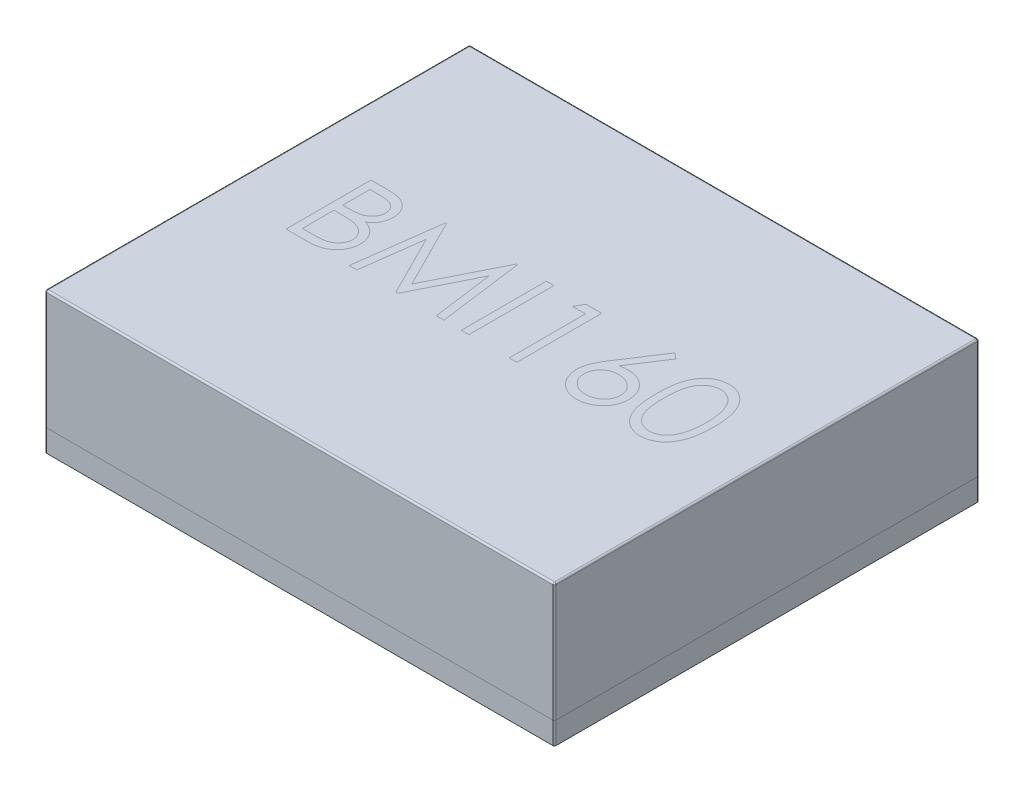
from build123d import *

# Parameters (mm, degrees)
IZIM1_W                       = 3
IZIM1_H                       = 2.5
Y_KSEKLIK_EKSTR_ZYON1_DEPTH   = 0.7
IZIM2_W                       = 3
IZIM2_H                       = 2.5
Y_KSEKLIK_EKSTR_ZYON2_DEPTH   = 0.13
RADYUS1_R                     = 0.01
RADYUS2_R                     = 0.01
IZIM3_W                       = 0.044871795
IZIM3_H                       = 0.5
KES_EKSTR_ZYON1_DEPTH         = 0.1
Y_KSEKLIK_EKSTR_ZYON3_DEPTH   = 0.1
Y_KSEKLIK_EKSTR_ZYON3_2_DEPTH = 0.1
IZIM3_2_W                     = 0.044871795
IZIM3_2_H                     = 0.5
Y_KSEKLIK_EKSTR_ZYON3_3_DEPTH = 0.1
Y_KSEKLIK_EKSTR_ZYON3_4_DEPTH = 0.1
Y_KSEKLIK_EKSTR_ZYON3_5_DEPTH = 0.1
Y_KSEKLIK_EKSTR_ZYON3_6_DEPTH = 0.1


with BuildPart() as part:
    # Çizim1 → Yükseklik-Ekstrüzyon1 (new body)
    with BuildSketch(Plane(origin=(0, 0, 0), x_dir=(1, 0, 0), z_dir=(0, 1, 0))):
        Rectangle(IZIM1_W, IZIM1_H)
    extrude(amount=Y_KSEKLIK_EKSTR_ZYON1_DEPTH)

    # Radyus1
    radyus1_edges = [part.edges().sort_by_distance(p)[0] for p in [
        (-1.5, 0.35, -1.25),
        (1.5, 0.35, -1.25),
        (-1.5, 0.35, 1.25),
        (1.5, 0.35, 1.25),
        (0, 0.7, -1.25),
        (-1.5, 0.7, 0),
        (1.5, 0.7, 0),
        (0, 0.7, 1.25),
    ]]
    fillet(radyus1_edges, radius=RADYUS1_R)

    # Çizim3 → Kes-Ekstrüzyon1 (cut)
    # profile 1 of 6: a face of its own
    with BuildSketch(Plane(origin=(0, 0.7, 0), x_dir=(1, 0, 0), z_dir=(0, 1, 0))):
        with BuildLine():
            Line((-1.099105135, 0.268739122), (-1.001549045, 0.268739122))
            add(Edge.make_bspline(
                [(-1.001549045, 0.268739122), (-0.996773548, 0.268714015), (-0.987517447, 0.268665351), (-0.974057526, 0.267910618), (-0.961450554, 0.266881522), (-0.949692872, 0.265248652), (-0.938789914, 0.263278398), (-0.928708823, 0.260892424), (-0.919481656, 0.258031479), (-0.908465551, 0.253482011), (-0.895905456, 0.246721558), (-0.882305686, 0.236731763), (-0.870676509, 0.22451284), (-0.860649892, 0.210729603), (-0.852678303, 0.19556735), (-0.846911261, 0.179387466), (-0.843260136, 0.162398646), (-0.842884645, 0.150735335), (-0.842694878, 0.144840885)],
                knots=[0, 0, 0, 0, 1.001505555, 1.941167018, 2.826882275, 3.653841531, 4.429895133, 5.150066043, 5.825578002, 6.45369114, 7.647487171, 8.808567382, 9.977351308, 11.170798116, 12.373658725, 13.556498008, 14.765093433, 16, 16, 16, 16], degree=3))
            add(Edge.make_bspline(
                [(-0.842694878, 0.144840885), (-0.842851052, 0.139319091), (-0.843157949, 0.128468246), (-0.846092629, 0.112597659), (-0.85068701, 0.097490342), (-0.857073475, 0.08320143), (-0.86537376, 0.070053771), (-0.875210662, 0.057941304), (-0.887078777, 0.047376868), (-0.895970668, 0.041470739), (-0.900487346, 0.038470693)],
                knots=[0, 0, 0, 0, 1.044552857, 2.05264487, 3.044412934, 4.028983338, 5.005914585, 5.980388656, 6.974128949, 8, 8, 8, 8], degree=3))
            add(Edge.make_bspline(
                [(-0.900487346, 0.038470693), (-0.894807285, 0.036289979), (-0.883939921, 0.032117732), (-0.868984777, 0.024741237), (-0.856099799, 0.016718079), (-0.845185921, 0.007956386), (-0.83585197, -0.00148773), (-0.82770155, -0.011752746), (-0.820747068, -0.022972569), (-0.814788079, -0.035030217), (-0.810138257, -0.047802569), (-0.806655985, -0.061169823), (-0.804660635, -0.075084045), (-0.804376686, -0.084553385), (-0.80423334, -0.089333794)],
                knots=[0, 0, 0, 0, 1.27268992, 2.434971085, 3.483601985, 4.442670788, 5.356604649, 6.2567628, 7.179492994, 8.113709626, 9.066344395, 10.018646069, 10.999752585, 12, 12, 12, 12], degree=3))
            add(Edge.make_bspline(
                [(-0.80423334, -0.089333794), (-0.804372889, -0.094214776), (-0.804647457, -0.103818245), (-0.806673167, -0.117926121), (-0.81010304, -0.131408256), (-0.814827489, -0.144351854), (-0.820993534, -0.156731873), (-0.828497529, -0.168562339), (-0.837444895, -0.179724386), (-0.847453876, -0.190342047), (-0.85877704, -0.199888874), (-0.870993576, -0.208391117), (-0.884257336, -0.215383412), (-0.898350478, -0.221257129), (-0.913431095, -0.225743872), (-0.929431467, -0.228882811), (-0.946337796, -0.230997816), (-0.957939189, -0.231171703), (-0.963888789, -0.231260878)],
                knots=[0, 0, 0, 0, 0.978564426, 1.925352924, 2.850884081, 3.763762016, 4.682927383, 5.618979971, 6.567305752, 7.547517671, 8.540179244, 9.531824382, 10.526200242, 11.540722885, 12.589160233, 13.674978461, 14.80764778, 16, 16, 16, 16], degree=3))
            Line((-0.963888789, -0.231260878), (-1.099105135, -0.231260878))
            Line((-1.099105135, -0.231260878), (-1.099105135, 0.268739122))
        make_face()
        with BuildLine():
            Line((-1.05423334, 0.217457071), (-1.05423334, 0.057200661))
            Line((-1.05423334, 0.057200661), (-1.024085103, 0.057200661))
            add(Edge.make_bspline(
                [(-1.024085103, 0.057200661), (-1.019678132, 0.057257792), (-1.011162966, 0.057368183), (-0.998831553, 0.0576844), (-0.987385121, 0.058569834), (-0.976843431, 0.059455015), (-0.967223082, 0.060894241), (-0.958545387, 0.062607402), (-0.950674159, 0.064419245), (-0.941597081, 0.067500601), (-0.931300946, 0.072054554), (-0.920324788, 0.07912196), (-0.910648435, 0.087539724), (-0.902477408, 0.097252719), (-0.895790056, 0.107947888), (-0.891145239, 0.119454585), (-0.887995627, 0.131486033), (-0.887711123, 0.139745783), (-0.887566673, 0.143939443)],
                knots=[0, 0, 0, 0, 1.156816544, 2.235205308, 3.236616184, 4.169592532, 5.011045266, 5.787822928, 6.49130361, 7.128639758, 8.301311294, 9.436451833, 10.541879658, 11.654887649, 12.756523258, 13.837046038, 14.901820046, 16, 16, 16, 16], degree=3))
            add(Edge.make_bspline(
                [(-0.887566673, 0.143939443), (-0.887641842, 0.146714553), (-0.887789293, 0.152158235), (-0.888996908, 0.160093857), (-0.891049419, 0.16755725), (-0.893685746, 0.174650694), (-0.897369845, 0.181152387), (-0.901707482, 0.187287129), (-0.906948295, 0.192846003), (-0.912913625, 0.198041646), (-0.919772, 0.202648007), (-0.927519328, 0.206682402), (-0.936260424, 0.209931084), (-0.945847975, 0.212776249), (-0.956429559, 0.214774577), (-0.967883067, 0.216439346), (-0.980302312, 0.217286881), (-0.98889447, 0.217399076), (-0.993335904, 0.217457071)],
                knots=[0, 0, 0, 0, 0.91205012, 1.789085906, 2.630437955, 3.453916878, 4.269457761, 5.079663411, 5.91843418, 6.774407191, 7.675494373, 8.627863946, 9.638891023, 10.736472738, 11.911756761, 13.175263542, 14.539845004, 16, 16, 16, 16], degree=3))
            Line((-0.993335904, 0.217457071), (-1.05423334, 0.217457071))
        make_face(mode=Mode.SUBTRACT)
        with BuildLine():
            Line((-1.05423334, 0.005918609), (-1.05423334, -0.179978827))
            Line((-1.05423334, -0.179978827), (-0.990331096, -0.179978827))
            add(Edge.make_bspline(
                [(-0.990331096, -0.179978827), (-0.985756964, -0.179924005), (-0.976940927, -0.179818345), (-0.96421218, -0.179473409), (-0.952414594, -0.178688798), (-0.941602003, -0.177453677), (-0.931657653, -0.176113898), (-0.922700838, -0.174312287), (-0.914658953, -0.172248149), (-0.905334052, -0.169057553), (-0.894833551, -0.164100915), (-0.883517714, -0.156627454), (-0.873456826, -0.147724124), (-0.864913217, -0.137419708), (-0.857911362, -0.126215232), (-0.852817725, -0.114337325), (-0.849676174, -0.10198225), (-0.849295865, -0.093558434), (-0.849105135, -0.089333794)],
                knots=[0, 0, 0, 0, 1.160039823, 2.235823828, 3.228722157, 4.157150951, 4.99529583, 5.772374946, 6.472645482, 7.099169577, 8.269452708, 9.405989375, 10.527446681, 11.663510218, 12.788923519, 13.866172445, 14.929861265, 16, 16, 16, 16], degree=3))
            add(Edge.make_bspline(
                [(-0.849105135, -0.089333794), (-0.849144578, -0.086691889), (-0.849222829, -0.081450691), (-0.850402917, -0.073748431), (-0.852119184, -0.066287592), (-0.85433796, -0.059047915), (-0.857569313, -0.05216029), (-0.861341676, -0.045488496), (-0.865764734, -0.039023713), (-0.872656757, -0.030850534), (-0.882681327, -0.021433818), (-0.896925152, -0.012214175), (-0.913121194, -0.004778774), (-0.924867979, -0.001621706), (-0.930936064, 9.154e-06)],
                knots=[0, 0, 0, 0, 0.723448775, 1.435228256, 2.130040452, 2.821711965, 3.505591119, 4.210454504, 4.921174351, 5.648778258, 7.137944449, 8.670945889, 10.280296675, 12, 12, 12, 12], degree=3))
            add(Edge.make_bspline(
                [(-0.930936064, 9.154e-06), (-0.933368792, 0.000502738), (-0.938643448, 0.001572928), (-0.947244531, 0.0027026), (-0.957063941, 0.003709037), (-0.968124352, 0.004453488), (-0.980439758, 0.005222995), (-0.994036461, 0.005522255), (-1.008858934, 0.005879292), (-1.019143559, 0.005905168), (-1.024485744, 0.005918609)],
                knots=[0, 0, 0, 0, 0.634451884, 1.375622551, 2.216452059, 3.157844607, 4.20941857, 5.370758133, 6.634282058, 8, 8, 8, 8], degree=3))
            Line((-1.024485744, 0.005918609), (-1.05423334, 0.005918609))
        make_face(mode=Mode.SUBTRACT)
    # profile 2 of 6: a face of its own
    with BuildSketch(Plane(origin=(0, 0.7, 0), x_dir=(1, 0, 0), z_dir=(0, 1, 0))):
        Polygon((-0.727310263, -0.231260878), (-0.661304654, 0.268739122), (-0.654894398, 0.268739122), (-0.448464109, -0.141517288), (-0.242534622, 0.268739122), (-0.236024205, 0.268739122), (-0.169617955, -0.231260878), (-0.214690071, -0.231260878), (-0.262566673, 0.128514763), (-0.443055455, -0.231260878), (-0.453171641, -0.231260878), (-0.634361545, 0.129316045), (-0.682137987, -0.231260878), align=None)
    # profile 3 of 6: a face of its own
    with BuildSketch(Plane(origin=(0, 0.7, 0), x_dir=(1, 0, 0), z_dir=(0, 1, 0))):
        with Locations((-0.044617956, 0.018739122)):
            Rectangle(IZIM3_W, IZIM3_H)
    # profile 4 of 6: a face of its own
    with BuildSketch(Plane(origin=(0, 0.7, 0), x_dir=(1, 0, 0), z_dir=(0, 1, 0))):
        Polygon((0.167421307, 0.268739122), (0.259869224, 0.268739122), (0.259869224, -0.231260878), (0.214997429, -0.231260878), (0.214997429, 0.217457071), (0.138074352, 0.217457071), align=None)
    # profile 5 of 6: a face of its own
    with BuildSketch(Plane(origin=(0, 0.7, 0), x_dir=(1, 0, 0), z_dir=(0, 1, 0))):
        with BuildLine():
            Line((0.676535891, 0.281559635), (0.711091179, 0.254416206))
            Line((0.711091179, 0.254416206), (0.578979801, 0.052392968))
            add(Edge.make_bspline(
                [(0.578979801, 0.052392968), (0.587775555, 0.053794948), (0.604932667, 0.056529669), (0.622299224, 0.056980804), (0.630762654, 0.057200661)],
                knots=[0, 0, 0, 0, 1.025318673, 2, 2, 2, 2], degree=3))
            add(Edge.make_bspline(
                [(0.630762654, 0.057200661), (0.635844439, 0.057064073), (0.645847782, 0.056795205), (0.660534468, 0.054726084), (0.674647173, 0.051465353), (0.688127403, 0.046712174), (0.701023543, 0.040640409), (0.7134096, 0.033363427), (0.725052744, 0.024505473), (0.736102913, 0.014610479), (0.746135355, 0.00365091), (0.755017649, -0.007977852), (0.762478619, -0.020263692), (0.768532037, -0.033200387), (0.773232734, -0.046767996), (0.77665954, -0.060949159), (0.778685196, -0.075753655), (0.778960266, -0.085821965), (0.779099993, -0.090936359)],
                knots=[0, 0, 0, 0, 1.04369286, 2.054478336, 3.041073146, 4.015093852, 4.984733326, 5.965804835, 6.960378782, 7.985147595, 9.009457201, 10.008161701, 10.986880575, 11.956520048, 12.937015923, 13.931873656, 14.949455224, 16, 16, 16, 16], degree=3))
            add(Edge.make_bspline(
                [(0.779099993, -0.090936359), (0.778896693, -0.097933459), (0.778496645, -0.111702097), (0.774510388, -0.131755912), (0.768316153, -0.150860557), (0.759462221, -0.16871101), (0.748464738, -0.185282806), (0.735053653, -0.199966444), (0.719704583, -0.213062164), (0.702349326, -0.224013109), (0.68367176, -0.232956402), (0.664050046, -0.239380008), (0.643674739, -0.24333479), (0.62984551, -0.24383059), (0.622849993, -0.244081391)],
                knots=[0, 0, 0, 0, 1.031375318, 2.029502543, 3.004789286, 3.987476834, 4.960371455, 5.9300674, 6.912260825, 7.929083631, 8.949397511, 9.960523116, 10.96833055, 12, 12, 12, 12], degree=3))
            add(Edge.make_bspline(
                [(0.622849993, -0.244081391), (0.616121893, -0.243863076), (0.602794705, -0.243430632), (0.58319002, -0.239578355), (0.564352446, -0.233334483), (0.546413963, -0.224732443), (0.529796733, -0.213867031), (0.514930213, -0.200786706), (0.501888531, -0.185771068), (0.491035014, -0.168822447), (0.482426624, -0.150609596), (0.47597092, -0.131618573), (0.472200028, -0.111918576), (0.471673091, -0.098564127), (0.471407686, -0.091837801)],
                knots=[0, 0, 0, 0, 1.012016664, 2.004627821, 2.994792927, 3.992885782, 4.990978636, 5.973936114, 6.964471063, 7.975201453, 8.993600317, 9.990122807, 10.98767138, 12, 12, 12, 12], degree=3))
            add(Edge.make_bspline(
                [(0.471407686, -0.091837801), (0.471576464, -0.086688575), (0.471921076, -0.076174839), (0.474327274, -0.060251406), (0.478193674, -0.043958394), (0.482523709, -0.030136367), (0.487098796, -0.018813292), (0.490906302, -0.009684222), (0.495645444, -0.000289783), (0.500698784, 0.009692165), (0.506521194, 0.02000437), (0.512852001, 0.030819179), (0.519866237, 0.041964598), (0.524783403, 0.049528054), (0.527297109, 0.053394571)],
                knots=[0, 0, 0, 0, 1.173818275, 2.396712641, 3.66331629, 4.989737886, 5.693666774, 6.447286557, 7.243889047, 8.091586357, 8.998013824, 9.943181721, 10.948533338, 12, 12, 12, 12], degree=3))
            Line((0.527297109, 0.053394571), (0.676535891, 0.281559635))
        make_face()
        with BuildLine():
            add(Edge.make_bspline(
                [(0.62134759, 0.005918609), (0.617538697, 0.00580746), (0.610098825, 0.005590354), (0.59918348, 0.004329603), (0.588853015, 0.001955451), (0.578970568, -0.00106831), (0.569720896, -0.00522589), (0.561036776, -0.010276147), (0.552884625, -0.01622203), (0.545349832, -0.022979303), (0.538518452, -0.030377593), (0.532635433, -0.038301811), (0.527560805, -0.046560983), (0.52343483, -0.055224117), (0.520221962, -0.064287903), (0.517897927, -0.073710653), (0.516604534, -0.083555554), (0.516389358, -0.090231626), (0.516279481, -0.093640686)],
                knots=[0, 0, 0, 0, 1.129588631, 2.206414736, 3.251139165, 4.268635594, 5.265702196, 6.250456724, 7.242448911, 8.251968645, 9.246821453, 10.222880186, 11.173611482, 12.116736599, 13.062300278, 14.020270554, 14.989073742, 16, 16, 16, 16], degree=3))
            add(Edge.make_bspline(
                [(0.516279481, -0.093640686), (0.516368961, -0.097019254), (0.516544418, -0.103644124), (0.518137607, -0.113406864), (0.52057119, -0.122801851), (0.524191246, -0.131780651), (0.528509373, -0.140480125), (0.534210134, -0.148585166), (0.540526818, -0.156588033), (0.54807738, -0.163873957), (0.556180717, -0.170653475), (0.564838032, -0.176579225), (0.573860883, -0.181648679), (0.583371086, -0.185621693), (0.593233713, -0.188882305), (0.603530935, -0.191176802), (0.614269914, -0.19247402), (0.621544477, -0.192689476), (0.62525384, -0.192799339)],
                knots=[0, 0, 0, 0, 0.989467248, 1.94019797, 2.891935182, 3.827694429, 4.772920941, 5.730924762, 6.725747692, 7.756678648, 8.79901574, 9.819492441, 10.826891316, 11.826466727, 12.835195252, 13.867842842, 14.912794438, 16, 16, 16, 16], degree=3))
            add(Edge.make_bspline(
                [(0.62525384, -0.192799339), (0.628963196, -0.192689468), (0.636237747, -0.192473995), (0.646976813, -0.191176899), (0.657273716, -0.188881949), (0.667137502, -0.185622982), (0.676643421, -0.181643895), (0.685658381, -0.176610764), (0.694233823, -0.170617033), (0.70234248, -0.163885543), (0.709861614, -0.156546564), (0.716329797, -0.148656604), (0.721855973, -0.140414619), (0.726346571, -0.13181492), (0.729926756, -0.122796422), (0.73237268, -0.113408318), (0.733962578, -0.103643743), (0.734138488, -0.097019125), (0.734228198, -0.093640686)],
                knots=[0, 0, 0, 0, 1.087397944, 2.132534446, 3.165364764, 4.174271784, 5.174024072, 6.181601208, 7.194203697, 8.236725232, 9.267838612, 10.269026844, 11.221737037, 12.171628256, 13.107553087, 14.05945871, 15.010357665, 16, 16, 16, 16], degree=3))
            add(Edge.make_bspline(
                [(0.734228198, -0.093640686), (0.734149585, -0.090227178), (0.733995293, -0.083527574), (0.732250157, -0.073715057), (0.729829818, -0.064240027), (0.7261751, -0.055162035), (0.721427022, -0.046516902), (0.715643678, -0.038260959), (0.708953311, -0.030330909), (0.701225091, -0.022964794), (0.6928122, -0.016229497), (0.683867117, -0.010283846), (0.674508835, -0.005265992), (0.664746843, -0.001079264), (0.654469288, 0.00194209), (0.643842097, 0.004321125), (0.632729348, 0.005587127), (0.625189832, 0.005806708), (0.62134759, 0.005918609)],
                knots=[0, 0, 0, 0, 0.978206639, 1.919901502, 2.851605144, 3.780102724, 4.718870031, 5.675451981, 6.667674623, 7.690630536, 8.733308323, 9.756129687, 10.767539656, 11.776269907, 12.797430371, 13.836405707, 14.897401972, 16, 16, 16, 16], degree=3))
        make_face(mode=Mode.SUBTRACT)
    # profile 6 of 6: a face of its own
    with BuildSketch(Plane(origin=(0, 0.7, 0), x_dir=(1, 0, 0), z_dir=(0, 1, 0))):
        with BuildLine():
            add(Edge.make_bspline(
                [(0.830382045, 0.018538802), (0.830428904, 0.026552714), (0.83051993, 0.042119855), (0.831532562, 0.064803375), (0.833214753, 0.086083416), (0.835520092, 0.105960997), (0.838325518, 0.124441249), (0.842070588, 0.141474786), (0.846329559, 0.157140444), (0.851265623, 0.171489308), (0.856835307, 0.184714694), (0.862897345, 0.197061152), (0.869692315, 0.208509999), (0.876831874, 0.219243969), (0.884605027, 0.229087354), (0.892790569, 0.238179163), (0.90170798, 0.24630927), (0.911054124, 0.253715885), (0.920913619, 0.260208667), (0.931005428, 0.265927629), (0.941399015, 0.270813325), (0.952122755, 0.274654815), (0.963080263, 0.277827794), (0.974309844, 0.279997643), (0.985830039, 0.281362916), (0.993605958, 0.28149344), (0.997549513, 0.281559635)],
                knots=[0, 0, 0, 0, 1.646270934, 3.197905019, 4.663502075, 6.030701355, 7.308322542, 8.50163776, 9.611534131, 10.641858119, 11.616356847, 12.558055219, 13.465016945, 14.349605745, 15.204443733, 16.039544428, 16.859896111, 17.680448484, 18.487036065, 19.28249412, 20.06191084, 20.843045899, 21.620316918, 22.403196591, 23.190181807, 24, 24, 24, 24], degree=3))
            add(Edge.make_bspline(
                [(0.997549513, 0.281559635), (1.00152601, 0.281489947), (1.009434011, 0.28135136), (1.021125493, 0.280019368), (1.032546876, 0.277809208), (1.043649467, 0.27467764), (1.054524465, 0.270792543), (1.065086809, 0.265922955), (1.075402107, 0.260254545), (1.085306433, 0.253593991), (1.094908521, 0.246167952), (1.103972516, 0.237773285), (1.112499243, 0.228494754), (1.120595715, 0.21843163), (1.128032229, 0.207390904), (1.135114148, 0.195564602), (1.14145301, 0.182745908), (1.147557964, 0.169148698), (1.152827533, 0.154396747), (1.157579854, 0.138573209), (1.161419706, 0.121491183), (1.164618174, 0.10324029), (1.167096016, 0.083753507), (1.168900679, 0.063072605), (1.169853977, 0.041183978), (1.170033506, 0.026218571), (1.170125634, 0.018538802)],
                knots=[0, 0, 0, 0, 0.810914788, 1.612654377, 2.396697861, 3.181598691, 3.963628158, 4.749916497, 5.551656086, 6.361998678, 7.18212741, 8.025565596, 8.878627764, 9.750805457, 10.657531673, 11.591944965, 12.560506719, 13.57287815, 14.630710178, 15.753379473, 16.941251878, 18.199788006, 19.531962791, 20.947069417, 22.433333509, 24, 24, 24, 24], degree=3))
            add(Edge.make_bspline(
                [(1.170125634, 0.018538802), (1.170032551, 0.010892529), (1.169851181, -0.004005921), (1.168911366, -0.025796061), (1.167060133, -0.04636721), (1.164744421, -0.065768704), (1.16153714, -0.083919793), (1.157593545, -0.100883285), (1.153214927, -0.116732438), (1.147809957, -0.131337411), (1.141894141, -0.144901943), (1.135457684, -0.157568679), (1.128561995, -0.169449578), (1.121049317, -0.180449542), (1.113041687, -0.190646493), (1.104367717, -0.199860439), (1.095271919, -0.208313392), (1.085641574, -0.215835053), (1.075582781, -0.222418596), (1.065302913, -0.228306289), (1.054619572, -0.233053817), (1.043774865, -0.237130252), (1.03261367, -0.240244602), (1.021149899, -0.24239801), (1.009441866, -0.243908274), (1.001527356, -0.244023485), (0.997549513, -0.244081391)],
                knots=[0, 0, 0, 0, 1.561518951, 3.042555995, 4.452378317, 5.7783523, 7.031515105, 8.214008947, 9.334062868, 10.386615937, 11.391082383, 12.354592575, 13.286541444, 14.194233754, 15.072674879, 15.931287219, 16.775624067, 17.606195743, 18.42308326, 19.229000347, 20.022332153, 20.807536673, 21.593273796, 22.3848459, 23.188221202, 24, 24, 24, 24], degree=3))
            add(Edge.make_bspline(
                [(0.997549513, -0.244081391), (0.993606068, -0.244014768), (0.985830364, -0.243883402), (0.974308589, -0.242524298), (0.963125383, -0.240339226), (0.952225561, -0.237279711), (0.941553202, -0.233534735), (0.931253732, -0.228655637), (0.921212634, -0.223036484), (0.911456698, -0.216637138), (0.902169246, -0.209305469), (0.893298017, -0.201196285), (0.885065871, -0.192107226), (0.877403858, -0.182181809), (0.870121845, -0.171511346), (0.863423363, -0.159950149), (0.857227527, -0.147544062), (0.851564171, -0.134212932), (0.846542933, -0.119762228), (0.842107547, -0.104026631), (0.838605524, -0.086867255), (0.835607959, -0.068421917), (0.83319019, -0.048611355), (0.831539572, -0.027424815), (0.830519384, -0.0048755), (0.83042866, 0.010591611), (0.830382045, 0.018538802)],
                knots=[0, 0, 0, 0, 0.810891512, 1.598919785, 2.382837074, 3.152667961, 3.926044502, 4.706494248, 5.493654104, 6.291793342, 7.103789334, 7.925228297, 8.761435821, 9.622817696, 10.50288917, 11.416980706, 12.369136599, 13.353924996, 14.394355917, 15.514179734, 16.714354668, 17.994756427, 19.357759367, 20.818452758, 22.365282078, 24, 24, 24, 24], degree=3))
        make_face()
        with BuildLine():
            add(Edge.make_bspline(
                [(0.87525384, 0.018739122), (0.875270903, 0.012060737), (0.875304021, -0.000900698), (0.876169193, -0.01973545), (0.877347797, -0.03730264), (0.878867982, -0.053624574), (0.881125546, -0.068646004), (0.883655088, -0.082470244), (0.886733386, -0.095024135), (0.890375532, -0.106393823), (0.894523974, -0.116772261), (0.899053383, -0.126429577), (0.903919201, -0.135479854), (0.909364794, -0.143841798), (0.915295517, -0.151542679), (0.921577411, -0.158718798), (0.928444923, -0.165118366), (0.937945458, -0.172793631), (0.950487811, -0.180724936), (0.966290733, -0.18763152), (0.982529083, -0.191971871), (0.993550691, -0.192523836), (0.999051916, -0.192799339)],
                knots=[0, 0, 0, 0, 1.459021318, 2.831673884, 4.118529203, 5.306027144, 6.411944654, 7.436330062, 8.375795394, 9.233974572, 10.042671642, 10.816086306, 11.563610507, 12.285937304, 12.993564865, 13.685989202, 14.367179055, 15.041617293, 16.353048772, 17.594441528, 18.799311195, 20, 20, 20, 20], degree=3))
            add(Edge.make_bspline(
                [(0.999051916, -0.192799339), (1.004588727, -0.192571085), (1.015650916, -0.192115047), (1.031812886, -0.187715228), (1.047502925, -0.181076722), (1.059798916, -0.173227079), (1.069153566, -0.165751603), (1.075855993, -0.159378082), (1.082007714, -0.152241529), (1.087842296, -0.14454163), (1.093193593, -0.136131275), (1.098059755, -0.127050907), (1.102500233, -0.11727531), (1.105030097, -0.110451062), (1.106323551, -0.106962)],
                knots=[0, 0, 0, 0, 1.353760809, 2.704726607, 4.075137775, 5.516104923, 6.260822281, 7.007110065, 7.778089737, 8.566572457, 9.372053459, 10.217411131, 11.088608312, 12, 12, 12, 12], degree=3))
            add(Edge.make_bspline(
                [(1.106323551, -0.106962), (1.107830946, -0.102500608), (1.110891606, -0.093442071), (1.114836145, -0.07939012), (1.11794263, -0.064646868), (1.120737397, -0.049300423), (1.122644976, -0.033237609), (1.124180378, -0.016508125), (1.125084762, 0.000900641), (1.125196869, 0.012728497), (1.12525384, 0.018739122)],
                knots=[0, 0, 0, 0, 0.884706709, 1.796334032, 2.740027952, 3.714592787, 4.726048262, 5.777819803, 6.87074269, 8, 8, 8, 8], degree=3))
            add(Edge.make_bspline(
                [(1.12525384, 0.018739122), (1.125175241, 0.024748775), (1.125021486, 0.036504942), (1.124433773, 0.053721825), (1.12291612, 0.070074362), (1.121230531, 0.085633001), (1.118745214, 0.100311616), (1.116065527, 0.114233088), (1.112465354, 0.127224948), (1.108619672, 0.139490603), (1.104218187, 0.150890697), (1.099373082, 0.16147838), (1.094198545, 0.17130477), (1.088578225, 0.180342904), (1.082578842, 0.188633267), (1.076042049, 0.196009638), (1.069227138, 0.202700633), (1.059681826, 0.210338143), (1.047185499, 0.218125528), (1.031636121, 0.225292065), (1.0154546, 0.229407536), (1.004515535, 0.229987777), (0.999051916, 0.230277584)],
                knots=[0, 0, 0, 0, 1.31362396, 2.569729283, 3.763502607, 4.902122613, 5.988968491, 7.01645872, 7.998833611, 8.933434873, 9.825090667, 10.667526885, 11.477055099, 12.250526234, 12.991942729, 13.710640831, 14.402115721, 15.076753259, 16.378508321, 17.609869233, 18.806226677, 20, 20, 20, 20], degree=3))
            add(Edge.make_bspline(
                [(0.999051916, 0.230277584), (0.993521832, 0.229987377), (0.982451588, 0.229406435), (0.96610188, 0.225307399), (0.95042983, 0.218162689), (0.937966548, 0.21031235), (0.928414579, 0.202835449), (0.921688479, 0.19635167), (0.915381883, 0.189259348), (0.909572212, 0.181487645), (0.904130886, 0.17313545), (0.899133598, 0.164137055), (0.894631123, 0.15444686), (0.890476189, 0.144073084), (0.886822933, 0.132704377), (0.88380951, 0.12016595), (0.881025645, 0.10638568), (0.879054893, 0.091282893), (0.877302928, 0.074956871), (0.876177021, 0.057345825), (0.875301127, 0.038479485), (0.875269918, 0.025451034), (0.87525384, 0.018739122)],
                knots=[0, 0, 0, 0, 1.207732386, 2.417664972, 3.655092373, 4.956220595, 5.625982001, 6.301752483, 6.994047911, 7.697131622, 8.419323945, 9.170223765, 9.943494443, 10.752040957, 11.610060368, 12.549350801, 13.567764191, 14.679664412, 15.874934091, 17.154273443, 18.533957287, 20, 20, 20, 20], degree=3))
        make_face(mode=Mode.SUBTRACT)
    extrude(amount=-KES_EKSTR_ZYON1_DEPTH, mode=Mode.SUBTRACT)


with BuildPart() as body_2:
    # Çizim2 → Yükseklik-Ekstrüzyon2 (new body)
    with BuildSketch(Plane.XZ):
        Rectangle(IZIM2_W, IZIM2_H)
    extrude(amount=Y_KSEKLIK_EKSTR_ZYON2_DEPTH)

    # Radyus2
    radyus2_edges = [body_2.edges().sort_by_distance(p)[0] for p in [
        (1.5, -0.065, 1.25),
        (-1.5, -0.065, 1.25),
        (1.5, -0.065, -1.25),
        (-1.5, -0.065, -1.25),
    ]]
    fillet(radyus2_edges, radius=RADYUS2_R)


with BuildPart() as body_3:
    # Çizim3<2> → Yükseklik-Ekstrüzyon3 (new body)
    with BuildSketch(Plane(origin=(0, 0.7, 0), x_dir=(1, 0, 0), z_dir=(0, 1, 0))):
        with BuildLine():
            Line((-1.099105135, 0.268739122), (-1.001549045, 0.268739122))
            add(Edge.make_bspline(
                [(-1.001549045, 0.268739122), (-0.996773548, 0.268714015), (-0.987517447, 0.268665351), (-0.974057526, 0.267910618), (-0.961450554, 0.266881522), (-0.949692872, 0.265248652), (-0.938789914, 0.263278398), (-0.928708823, 0.260892424), (-0.919481656, 0.258031479), (-0.908465551, 0.253482011), (-0.895905456, 0.246721558), (-0.882305686, 0.236731763), (-0.870676509, 0.22451284), (-0.860649892, 0.210729603), (-0.852678303, 0.19556735), (-0.846911261, 0.179387466), (-0.843260136, 0.162398646), (-0.842884645, 0.150735335), (-0.842694878, 0.144840885)],
                knots=[0, 0, 0, 0, 1.001505555, 1.941167018, 2.826882275, 3.653841531, 4.429895133, 5.150066043, 5.825578002, 6.45369114, 7.647487171, 8.808567382, 9.977351308, 11.170798116, 12.373658725, 13.556498008, 14.765093433, 16, 16, 16, 16], degree=3))
            add(Edge.make_bspline(
                [(-0.842694878, 0.144840885), (-0.842851052, 0.139319091), (-0.843157949, 0.128468246), (-0.846092629, 0.112597659), (-0.85068701, 0.097490342), (-0.857073475, 0.08320143), (-0.86537376, 0.070053771), (-0.875210662, 0.057941304), (-0.887078777, 0.047376868), (-0.895970668, 0.041470739), (-0.900487346, 0.038470693)],
                knots=[0, 0, 0, 0, 1.044552857, 2.05264487, 3.044412934, 4.028983338, 5.005914585, 5.980388656, 6.974128949, 8, 8, 8, 8], degree=3))
            add(Edge.make_bspline(
                [(-0.900487346, 0.038470693), (-0.894807285, 0.036289979), (-0.883939921, 0.032117732), (-0.868984777, 0.024741237), (-0.856099799, 0.016718079), (-0.845185921, 0.007956386), (-0.83585197, -0.00148773), (-0.82770155, -0.011752746), (-0.820747068, -0.022972569), (-0.814788079, -0.035030217), (-0.810138257, -0.047802569), (-0.806655985, -0.061169823), (-0.804660635, -0.075084045), (-0.804376686, -0.084553385), (-0.80423334, -0.089333794)],
                knots=[0, 0, 0, 0, 1.27268992, 2.434971085, 3.483601985, 4.442670788, 5.356604649, 6.2567628, 7.179492994, 8.113709626, 9.066344395, 10.018646069, 10.999752585, 12, 12, 12, 12], degree=3))
            add(Edge.make_bspline(
                [(-0.80423334, -0.089333794), (-0.804372889, -0.094214776), (-0.804647457, -0.103818245), (-0.806673167, -0.117926121), (-0.81010304, -0.131408256), (-0.814827489, -0.144351854), (-0.820993534, -0.156731873), (-0.828497529, -0.168562339), (-0.837444895, -0.179724386), (-0.847453876, -0.190342047), (-0.85877704, -0.199888874), (-0.870993576, -0.208391117), (-0.884257336, -0.215383412), (-0.898350478, -0.221257129), (-0.913431095, -0.225743872), (-0.929431467, -0.228882811), (-0.946337796, -0.230997816), (-0.957939189, -0.231171703), (-0.963888789, -0.231260878)],
                knots=[0, 0, 0, 0, 0.978564426, 1.925352924, 2.850884081, 3.763762016, 4.682927383, 5.618979971, 6.567305752, 7.547517671, 8.540179244, 9.531824382, 10.526200242, 11.540722885, 12.589160233, 13.674978461, 14.80764778, 16, 16, 16, 16], degree=3))
            Line((-0.963888789, -0.231260878), (-1.099105135, -0.231260878))
            Line((-1.099105135, -0.231260878), (-1.099105135, 0.268739122))
        make_face()
        with BuildLine():
            Line((-1.05423334, 0.217457071), (-1.05423334, 0.057200661))
            Line((-1.05423334, 0.057200661), (-1.024085103, 0.057200661))
            add(Edge.make_bspline(
                [(-1.024085103, 0.057200661), (-1.019678132, 0.057257792), (-1.011162966, 0.057368183), (-0.998831553, 0.0576844), (-0.987385121, 0.058569834), (-0.976843431, 0.059455015), (-0.967223082, 0.060894241), (-0.958545387, 0.062607402), (-0.950674159, 0.064419245), (-0.941597081, 0.067500601), (-0.931300946, 0.072054554), (-0.920324788, 0.07912196), (-0.910648435, 0.087539724), (-0.902477408, 0.097252719), (-0.895790056, 0.107947888), (-0.891145239, 0.119454585), (-0.887995627, 0.131486033), (-0.887711123, 0.139745783), (-0.887566673, 0.143939443)],
                knots=[0, 0, 0, 0, 1.156816544, 2.235205308, 3.236616184, 4.169592532, 5.011045266, 5.787822928, 6.49130361, 7.128639758, 8.301311294, 9.436451833, 10.541879658, 11.654887649, 12.756523258, 13.837046038, 14.901820046, 16, 16, 16, 16], degree=3))
            add(Edge.make_bspline(
                [(-0.887566673, 0.143939443), (-0.887641842, 0.146714553), (-0.887789293, 0.152158235), (-0.888996908, 0.160093857), (-0.891049419, 0.16755725), (-0.893685746, 0.174650694), (-0.897369845, 0.181152387), (-0.901707482, 0.187287129), (-0.906948295, 0.192846003), (-0.912913625, 0.198041646), (-0.919772, 0.202648007), (-0.927519328, 0.206682402), (-0.936260424, 0.209931084), (-0.945847975, 0.212776249), (-0.956429559, 0.214774577), (-0.967883067, 0.216439346), (-0.980302312, 0.217286881), (-0.98889447, 0.217399076), (-0.993335904, 0.217457071)],
                knots=[0, 0, 0, 0, 0.91205012, 1.789085906, 2.630437955, 3.453916878, 4.269457761, 5.079663411, 5.91843418, 6.774407191, 7.675494373, 8.627863946, 9.638891023, 10.736472738, 11.911756761, 13.175263542, 14.539845004, 16, 16, 16, 16], degree=3))
            Line((-0.993335904, 0.217457071), (-1.05423334, 0.217457071))
        make_face(mode=Mode.SUBTRACT)
        with BuildLine():
            Line((-1.05423334, 0.005918609), (-1.05423334, -0.179978827))
            Line((-1.05423334, -0.179978827), (-0.990331096, -0.179978827))
            add(Edge.make_bspline(
                [(-0.990331096, -0.179978827), (-0.985756964, -0.179924005), (-0.976940927, -0.179818345), (-0.96421218, -0.179473409), (-0.952414594, -0.178688798), (-0.941602003, -0.177453677), (-0.931657653, -0.176113898), (-0.922700838, -0.174312287), (-0.914658953, -0.172248149), (-0.905334052, -0.169057553), (-0.894833551, -0.164100915), (-0.883517714, -0.156627454), (-0.873456826, -0.147724124), (-0.864913217, -0.137419708), (-0.857911362, -0.126215232), (-0.852817725, -0.114337325), (-0.849676174, -0.10198225), (-0.849295865, -0.093558434), (-0.849105135, -0.089333794)],
                knots=[0, 0, 0, 0, 1.160039823, 2.235823828, 3.228722157, 4.157150951, 4.99529583, 5.772374946, 6.472645482, 7.099169577, 8.269452708, 9.405989375, 10.527446681, 11.663510218, 12.788923519, 13.866172445, 14.929861265, 16, 16, 16, 16], degree=3))
            add(Edge.make_bspline(
                [(-0.849105135, -0.089333794), (-0.849144578, -0.086691889), (-0.849222829, -0.081450691), (-0.850402917, -0.073748431), (-0.852119184, -0.066287592), (-0.85433796, -0.059047915), (-0.857569313, -0.05216029), (-0.861341676, -0.045488496), (-0.865764734, -0.039023713), (-0.872656757, -0.030850534), (-0.882681327, -0.021433818), (-0.896925152, -0.012214175), (-0.913121194, -0.004778774), (-0.924867979, -0.001621706), (-0.930936064, 9.154e-06)],
                knots=[0, 0, 0, 0, 0.723448775, 1.435228256, 2.130040452, 2.821711965, 3.505591119, 4.210454504, 4.921174351, 5.648778258, 7.137944449, 8.670945889, 10.280296675, 12, 12, 12, 12], degree=3))
            add(Edge.make_bspline(
                [(-0.930936064, 9.154e-06), (-0.933368792, 0.000502738), (-0.938643448, 0.001572928), (-0.947244531, 0.0027026), (-0.957063941, 0.003709037), (-0.968124352, 0.004453488), (-0.980439758, 0.005222995), (-0.994036461, 0.005522255), (-1.008858934, 0.005879292), (-1.019143559, 0.005905168), (-1.024485744, 0.005918609)],
                knots=[0, 0, 0, 0, 0.634451884, 1.375622551, 2.216452059, 3.157844607, 4.20941857, 5.370758133, 6.634282058, 8, 8, 8, 8], degree=3))
            Line((-1.024485744, 0.005918609), (-1.05423334, 0.005918609))
        make_face(mode=Mode.SUBTRACT)
    extrude(amount=-Y_KSEKLIK_EKSTR_ZYON3_DEPTH)


with BuildPart() as body_4:
    # Çizim3<2> → Y_kseklik-Ekstr_zyon3 2 (new body)
    with BuildSketch(Plane(origin=(0, 0.7, 0), x_dir=(1, 0, 0), z_dir=(0, 1, 0))):
        Polygon((-0.727310263, -0.231260878), (-0.661304654, 0.268739122), (-0.654894398, 0.268739122), (-0.448464109, -0.141517288), (-0.242534622, 0.268739122), (-0.236024205, 0.268739122), (-0.169617955, -0.231260878), (-0.214690071, -0.231260878), (-0.262566673, 0.128514763), (-0.443055455, -0.231260878), (-0.453171641, -0.231260878), (-0.634361545, 0.129316045), (-0.682137987, -0.231260878), align=None)
    extrude(amount=-Y_KSEKLIK_EKSTR_ZYON3_2_DEPTH)


with BuildPart() as body_5:
    # Çizim3<2> → Y_kseklik-Ekstr_zyon3 3 (new body)
    with BuildSketch(Plane(origin=(0, 0.7, 0), x_dir=(1, 0, 0), z_dir=(0, 1, 0))):
        with Locations((-0.044617956, 0.018739122)):
            Rectangle(IZIM3_2_W, IZIM3_2_H)
    extrude(amount=-Y_KSEKLIK_EKSTR_ZYON3_3_DEPTH)


with BuildPart() as body_6:
    # Çizim3<2> → Y_kseklik-Ekstr_zyon3 4 (new body)
    with BuildSketch(Plane(origin=(0, 0.7, 0), x_dir=(1, 0, 0), z_dir=(0, 1, 0))):
        Polygon((0.167421307, 0.268739122), (0.259869224, 0.268739122), (0.259869224, -0.231260878), (0.214997429, -0.231260878), (0.214997429, 0.217457071), (0.138074352, 0.217457071), align=None)
    extrude(amount=-Y_KSEKLIK_EKSTR_ZYON3_4_DEPTH)


with BuildPart() as body_7:
    # Çizim3<2> → Y_kseklik-Ekstr_zyon3 5 (new body)
    with BuildSketch(Plane(origin=(0, 0.7, 0), x_dir=(1, 0, 0), z_dir=(0, 1, 0))):
        with BuildLine():
            Line((0.676535891, 0.281559635), (0.711091179, 0.254416206))
            Line((0.711091179, 0.254416206), (0.578979801, 0.052392968))
            add(Edge.make_bspline(
                [(0.578979801, 0.052392968), (0.587775555, 0.053794948), (0.604932667, 0.056529669), (0.622299224, 0.056980804), (0.630762654, 0.057200661)],
                knots=[0, 0, 0, 0, 1.025318673, 2, 2, 2, 2], degree=3))
            add(Edge.make_bspline(
                [(0.630762654, 0.057200661), (0.635844439, 0.057064073), (0.645847782, 0.056795205), (0.660534468, 0.054726084), (0.674647173, 0.051465353), (0.688127403, 0.046712174), (0.701023543, 0.040640409), (0.7134096, 0.033363427), (0.725052744, 0.024505473), (0.736102913, 0.014610479), (0.746135355, 0.00365091), (0.755017649, -0.007977852), (0.762478619, -0.020263692), (0.768532037, -0.033200387), (0.773232734, -0.046767996), (0.77665954, -0.060949159), (0.778685196, -0.075753655), (0.778960266, -0.085821965), (0.779099993, -0.090936359)],
                knots=[0, 0, 0, 0, 1.04369286, 2.054478336, 3.041073146, 4.015093852, 4.984733326, 5.965804835, 6.960378782, 7.985147595, 9.009457201, 10.008161701, 10.986880575, 11.956520048, 12.937015923, 13.931873656, 14.949455224, 16, 16, 16, 16], degree=3))
            add(Edge.make_bspline(
                [(0.779099993, -0.090936359), (0.778896693, -0.097933459), (0.778496645, -0.111702097), (0.774510388, -0.131755912), (0.768316153, -0.150860557), (0.759462221, -0.16871101), (0.748464738, -0.185282806), (0.735053653, -0.199966444), (0.719704583, -0.213062164), (0.702349326, -0.224013109), (0.68367176, -0.232956402), (0.664050046, -0.239380008), (0.643674739, -0.24333479), (0.62984551, -0.24383059), (0.622849993, -0.244081391)],
                knots=[0, 0, 0, 0, 1.031375318, 2.029502543, 3.004789286, 3.987476834, 4.960371455, 5.9300674, 6.912260825, 7.929083631, 8.949397511, 9.960523116, 10.96833055, 12, 12, 12, 12], degree=3))
            add(Edge.make_bspline(
                [(0.622849993, -0.244081391), (0.616121893, -0.243863076), (0.602794705, -0.243430632), (0.58319002, -0.239578355), (0.564352446, -0.233334483), (0.546413963, -0.224732443), (0.529796733, -0.213867031), (0.514930213, -0.200786706), (0.501888531, -0.185771068), (0.491035014, -0.168822447), (0.482426624, -0.150609596), (0.47597092, -0.131618573), (0.472200028, -0.111918576), (0.471673091, -0.098564127), (0.471407686, -0.091837801)],
                knots=[0, 0, 0, 0, 1.012016664, 2.004627821, 2.994792927, 3.992885782, 4.990978636, 5.973936114, 6.964471063, 7.975201453, 8.993600317, 9.990122807, 10.98767138, 12, 12, 12, 12], degree=3))
            add(Edge.make_bspline(
                [(0.471407686, -0.091837801), (0.471576464, -0.086688575), (0.471921076, -0.076174839), (0.474327274, -0.060251406), (0.478193674, -0.043958394), (0.482523709, -0.030136367), (0.487098796, -0.018813292), (0.490906302, -0.009684222), (0.495645444, -0.000289783), (0.500698784, 0.009692165), (0.506521194, 0.02000437), (0.512852001, 0.030819179), (0.519866237, 0.041964598), (0.524783403, 0.049528054), (0.527297109, 0.053394571)],
                knots=[0, 0, 0, 0, 1.173818275, 2.396712641, 3.66331629, 4.989737886, 5.693666774, 6.447286557, 7.243889047, 8.091586357, 8.998013824, 9.943181721, 10.948533338, 12, 12, 12, 12], degree=3))
            Line((0.527297109, 0.053394571), (0.676535891, 0.281559635))
        make_face()
        with BuildLine():
            add(Edge.make_bspline(
                [(0.62134759, 0.005918609), (0.617538697, 0.00580746), (0.610098825, 0.005590354), (0.59918348, 0.004329603), (0.588853015, 0.001955451), (0.578970568, -0.00106831), (0.569720896, -0.00522589), (0.561036776, -0.010276147), (0.552884625, -0.01622203), (0.545349832, -0.022979303), (0.538518452, -0.030377593), (0.532635433, -0.038301811), (0.527560805, -0.046560983), (0.52343483, -0.055224117), (0.520221962, -0.064287903), (0.517897927, -0.073710653), (0.516604534, -0.083555554), (0.516389358, -0.090231626), (0.516279481, -0.093640686)],
                knots=[0, 0, 0, 0, 1.129588631, 2.206414736, 3.251139165, 4.268635594, 5.265702196, 6.250456724, 7.242448911, 8.251968645, 9.246821453, 10.222880186, 11.173611482, 12.116736599, 13.062300278, 14.020270554, 14.989073742, 16, 16, 16, 16], degree=3))
            add(Edge.make_bspline(
                [(0.516279481, -0.093640686), (0.516368961, -0.097019254), (0.516544418, -0.103644124), (0.518137607, -0.113406864), (0.52057119, -0.122801851), (0.524191246, -0.131780651), (0.528509373, -0.140480125), (0.534210134, -0.148585166), (0.540526818, -0.156588033), (0.54807738, -0.163873957), (0.556180717, -0.170653475), (0.564838032, -0.176579225), (0.573860883, -0.181648679), (0.583371086, -0.185621693), (0.593233713, -0.188882305), (0.603530935, -0.191176802), (0.614269914, -0.19247402), (0.621544477, -0.192689476), (0.62525384, -0.192799339)],
                knots=[0, 0, 0, 0, 0.989467248, 1.94019797, 2.891935182, 3.827694429, 4.772920941, 5.730924762, 6.725747692, 7.756678648, 8.79901574, 9.819492441, 10.826891316, 11.826466727, 12.835195252, 13.867842842, 14.912794438, 16, 16, 16, 16], degree=3))
            add(Edge.make_bspline(
                [(0.62525384, -0.192799339), (0.628963196, -0.192689468), (0.636237747, -0.192473995), (0.646976813, -0.191176899), (0.657273716, -0.188881949), (0.667137502, -0.185622982), (0.676643421, -0.181643895), (0.685658381, -0.176610764), (0.694233823, -0.170617033), (0.70234248, -0.163885543), (0.709861614, -0.156546564), (0.716329797, -0.148656604), (0.721855973, -0.140414619), (0.726346571, -0.13181492), (0.729926756, -0.122796422), (0.73237268, -0.113408318), (0.733962578, -0.103643743), (0.734138488, -0.097019125), (0.734228198, -0.093640686)],
                knots=[0, 0, 0, 0, 1.087397944, 2.132534446, 3.165364764, 4.174271784, 5.174024072, 6.181601208, 7.194203697, 8.236725232, 9.267838612, 10.269026844, 11.221737037, 12.171628256, 13.107553087, 14.05945871, 15.010357665, 16, 16, 16, 16], degree=3))
            add(Edge.make_bspline(
                [(0.734228198, -0.093640686), (0.734149585, -0.090227178), (0.733995293, -0.083527574), (0.732250157, -0.073715057), (0.729829818, -0.064240027), (0.7261751, -0.055162035), (0.721427022, -0.046516902), (0.715643678, -0.038260959), (0.708953311, -0.030330909), (0.701225091, -0.022964794), (0.6928122, -0.016229497), (0.683867117, -0.010283846), (0.674508835, -0.005265992), (0.664746843, -0.001079264), (0.654469288, 0.00194209), (0.643842097, 0.004321125), (0.632729348, 0.005587127), (0.625189832, 0.005806708), (0.62134759, 0.005918609)],
                knots=[0, 0, 0, 0, 0.978206639, 1.919901502, 2.851605144, 3.780102724, 4.718870031, 5.675451981, 6.667674623, 7.690630536, 8.733308323, 9.756129687, 10.767539656, 11.776269907, 12.797430371, 13.836405707, 14.897401972, 16, 16, 16, 16], degree=3))
        make_face(mode=Mode.SUBTRACT)
    extrude(amount=-Y_KSEKLIK_EKSTR_ZYON3_5_DEPTH)


with BuildPart() as body_8:
    # Çizim3<2> → Y_kseklik-Ekstr_zyon3 6 (new body)
    with BuildSketch(Plane(origin=(0, 0.7, 0), x_dir=(1, 0, 0), z_dir=(0, 1, 0))):
        with BuildLine():
            add(Edge.make_bspline(
                [(0.830382045, 0.018538802), (0.830428904, 0.026552714), (0.83051993, 0.042119855), (0.831532562, 0.064803375), (0.833214753, 0.086083416), (0.835520092, 0.105960997), (0.838325518, 0.124441249), (0.842070588, 0.141474786), (0.846329559, 0.157140444), (0.851265623, 0.171489308), (0.856835307, 0.184714694), (0.862897345, 0.197061152), (0.869692315, 0.208509999), (0.876831874, 0.219243969), (0.884605027, 0.229087354), (0.892790569, 0.238179163), (0.90170798, 0.24630927), (0.911054124, 0.253715885), (0.920913619, 0.260208667), (0.931005428, 0.265927629), (0.941399015, 0.270813325), (0.952122755, 0.274654815), (0.963080263, 0.277827794), (0.974309844, 0.279997643), (0.985830039, 0.281362916), (0.993605958, 0.28149344), (0.997549513, 0.281559635)],
                knots=[0, 0, 0, 0, 1.646270934, 3.197905019, 4.663502075, 6.030701355, 7.308322542, 8.50163776, 9.611534131, 10.641858119, 11.616356847, 12.558055219, 13.465016945, 14.349605745, 15.204443733, 16.039544428, 16.859896111, 17.680448484, 18.487036065, 19.28249412, 20.06191084, 20.843045899, 21.620316918, 22.403196591, 23.190181807, 24, 24, 24, 24], degree=3))
            add(Edge.make_bspline(
                [(0.997549513, 0.281559635), (1.00152601, 0.281489947), (1.009434011, 0.28135136), (1.021125493, 0.280019368), (1.032546876, 0.277809208), (1.043649467, 0.27467764), (1.054524465, 0.270792543), (1.065086809, 0.265922955), (1.075402107, 0.260254545), (1.085306433, 0.253593991), (1.094908521, 0.246167952), (1.103972516, 0.237773285), (1.112499243, 0.228494754), (1.120595715, 0.21843163), (1.128032229, 0.207390904), (1.135114148, 0.195564602), (1.14145301, 0.182745908), (1.147557964, 0.169148698), (1.152827533, 0.154396747), (1.157579854, 0.138573209), (1.161419706, 0.121491183), (1.164618174, 0.10324029), (1.167096016, 0.083753507), (1.168900679, 0.063072605), (1.169853977, 0.041183978), (1.170033506, 0.026218571), (1.170125634, 0.018538802)],
                knots=[0, 0, 0, 0, 0.810914788, 1.612654377, 2.396697861, 3.181598691, 3.963628158, 4.749916497, 5.551656086, 6.361998678, 7.18212741, 8.025565596, 8.878627764, 9.750805457, 10.657531673, 11.591944965, 12.560506719, 13.57287815, 14.630710178, 15.753379473, 16.941251878, 18.199788006, 19.531962791, 20.947069417, 22.433333509, 24, 24, 24, 24], degree=3))
            add(Edge.make_bspline(
                [(1.170125634, 0.018538802), (1.170032551, 0.010892529), (1.169851181, -0.004005921), (1.168911366, -0.025796061), (1.167060133, -0.04636721), (1.164744421, -0.065768704), (1.16153714, -0.083919793), (1.157593545, -0.100883285), (1.153214927, -0.116732438), (1.147809957, -0.131337411), (1.141894141, -0.144901943), (1.135457684, -0.157568679), (1.128561995, -0.169449578), (1.121049317, -0.180449542), (1.113041687, -0.190646493), (1.104367717, -0.199860439), (1.095271919, -0.208313392), (1.085641574, -0.215835053), (1.075582781, -0.222418596), (1.065302913, -0.228306289), (1.054619572, -0.233053817), (1.043774865, -0.237130252), (1.03261367, -0.240244602), (1.021149899, -0.24239801), (1.009441866, -0.243908274), (1.001527356, -0.244023485), (0.997549513, -0.244081391)],
                knots=[0, 0, 0, 0, 1.561518951, 3.042555995, 4.452378317, 5.7783523, 7.031515105, 8.214008947, 9.334062868, 10.386615937, 11.391082383, 12.354592575, 13.286541444, 14.194233754, 15.072674879, 15.931287219, 16.775624067, 17.606195743, 18.42308326, 19.229000347, 20.022332153, 20.807536673, 21.593273796, 22.3848459, 23.188221202, 24, 24, 24, 24], degree=3))
            add(Edge.make_bspline(
                [(0.997549513, -0.244081391), (0.993606068, -0.244014768), (0.985830364, -0.243883402), (0.974308589, -0.242524298), (0.963125383, -0.240339226), (0.952225561, -0.237279711), (0.941553202, -0.233534735), (0.931253732, -0.228655637), (0.921212634, -0.223036484), (0.911456698, -0.216637138), (0.902169246, -0.209305469), (0.893298017, -0.201196285), (0.885065871, -0.192107226), (0.877403858, -0.182181809), (0.870121845, -0.171511346), (0.863423363, -0.159950149), (0.857227527, -0.147544062), (0.851564171, -0.134212932), (0.846542933, -0.119762228), (0.842107547, -0.104026631), (0.838605524, -0.086867255), (0.835607959, -0.068421917), (0.83319019, -0.048611355), (0.831539572, -0.027424815), (0.830519384, -0.0048755), (0.83042866, 0.010591611), (0.830382045, 0.018538802)],
                knots=[0, 0, 0, 0, 0.810891512, 1.598919785, 2.382837074, 3.152667961, 3.926044502, 4.706494248, 5.493654104, 6.291793342, 7.103789334, 7.925228297, 8.761435821, 9.622817696, 10.50288917, 11.416980706, 12.369136599, 13.353924996, 14.394355917, 15.514179734, 16.714354668, 17.994756427, 19.357759367, 20.818452758, 22.365282078, 24, 24, 24, 24], degree=3))
        make_face()
        with BuildLine():
            add(Edge.make_bspline(
                [(0.87525384, 0.018739122), (0.875270903, 0.012060737), (0.875304021, -0.000900698), (0.876169193, -0.01973545), (0.877347797, -0.03730264), (0.878867982, -0.053624574), (0.881125546, -0.068646004), (0.883655088, -0.082470244), (0.886733386, -0.095024135), (0.890375532, -0.106393823), (0.894523974, -0.116772261), (0.899053383, -0.126429577), (0.903919201, -0.135479854), (0.909364794, -0.143841798), (0.915295517, -0.151542679), (0.921577411, -0.158718798), (0.928444923, -0.165118366), (0.937945458, -0.172793631), (0.950487811, -0.180724936), (0.966290733, -0.18763152), (0.982529083, -0.191971871), (0.993550691, -0.192523836), (0.999051916, -0.192799339)],
                knots=[0, 0, 0, 0, 1.459021318, 2.831673884, 4.118529203, 5.306027144, 6.411944654, 7.436330062, 8.375795394, 9.233974572, 10.042671642, 10.816086306, 11.563610507, 12.285937304, 12.993564865, 13.685989202, 14.367179055, 15.041617293, 16.353048772, 17.594441528, 18.799311195, 20, 20, 20, 20], degree=3))
            add(Edge.make_bspline(
                [(0.999051916, -0.192799339), (1.004588727, -0.192571085), (1.015650916, -0.192115047), (1.031812886, -0.187715228), (1.047502925, -0.181076722), (1.059798916, -0.173227079), (1.069153566, -0.165751603), (1.075855993, -0.159378082), (1.082007714, -0.152241529), (1.087842296, -0.14454163), (1.093193593, -0.136131275), (1.098059755, -0.127050907), (1.102500233, -0.11727531), (1.105030097, -0.110451062), (1.106323551, -0.106962)],
                knots=[0, 0, 0, 0, 1.353760809, 2.704726607, 4.075137775, 5.516104923, 6.260822281, 7.007110065, 7.778089737, 8.566572457, 9.372053459, 10.217411131, 11.088608312, 12, 12, 12, 12], degree=3))
            add(Edge.make_bspline(
                [(1.106323551, -0.106962), (1.107830946, -0.102500608), (1.110891606, -0.093442071), (1.114836145, -0.07939012), (1.11794263, -0.064646868), (1.120737397, -0.049300423), (1.122644976, -0.033237609), (1.124180378, -0.016508125), (1.125084762, 0.000900641), (1.125196869, 0.012728497), (1.12525384, 0.018739122)],
                knots=[0, 0, 0, 0, 0.884706709, 1.796334032, 2.740027952, 3.714592787, 4.726048262, 5.777819803, 6.87074269, 8, 8, 8, 8], degree=3))
            add(Edge.make_bspline(
                [(1.12525384, 0.018739122), (1.125175241, 0.024748775), (1.125021486, 0.036504942), (1.124433773, 0.053721825), (1.12291612, 0.070074362), (1.121230531, 0.085633001), (1.118745214, 0.100311616), (1.116065527, 0.114233088), (1.112465354, 0.127224948), (1.108619672, 0.139490603), (1.104218187, 0.150890697), (1.099373082, 0.16147838), (1.094198545, 0.17130477), (1.088578225, 0.180342904), (1.082578842, 0.188633267), (1.076042049, 0.196009638), (1.069227138, 0.202700633), (1.059681826, 0.210338143), (1.047185499, 0.218125528), (1.031636121, 0.225292065), (1.0154546, 0.229407536), (1.004515535, 0.229987777), (0.999051916, 0.230277584)],
                knots=[0, 0, 0, 0, 1.31362396, 2.569729283, 3.763502607, 4.902122613, 5.988968491, 7.01645872, 7.998833611, 8.933434873, 9.825090667, 10.667526885, 11.477055099, 12.250526234, 12.991942729, 13.710640831, 14.402115721, 15.076753259, 16.378508321, 17.609869233, 18.806226677, 20, 20, 20, 20], degree=3))
            add(Edge.make_bspline(
                [(0.999051916, 0.230277584), (0.993521832, 0.229987377), (0.982451588, 0.229406435), (0.96610188, 0.225307399), (0.95042983, 0.218162689), (0.937966548, 0.21031235), (0.928414579, 0.202835449), (0.921688479, 0.19635167), (0.915381883, 0.189259348), (0.909572212, 0.181487645), (0.904130886, 0.17313545), (0.899133598, 0.164137055), (0.894631123, 0.15444686), (0.890476189, 0.144073084), (0.886822933, 0.132704377), (0.88380951, 0.12016595), (0.881025645, 0.10638568), (0.879054893, 0.091282893), (0.877302928, 0.074956871), (0.876177021, 0.057345825), (0.875301127, 0.038479485), (0.875269918, 0.025451034), (0.87525384, 0.018739122)],
                knots=[0, 0, 0, 0, 1.207732386, 2.417664972, 3.655092373, 4.956220595, 5.625982001, 6.301752483, 6.994047911, 7.697131622, 8.419323945, 9.170223765, 9.943494443, 10.752040957, 11.610060368, 12.549350801, 13.567764191, 14.679664412, 15.874934091, 17.154273443, 18.533957287, 20, 20, 20, 20], degree=3))
        make_face(mode=Mode.SUBTRACT)
    extrude(amount=-Y_KSEKLIK_EKSTR_ZYON3_6_DEPTH)


solid = Compound([part.part, body_2.part, body_3.part, body_4.part, body_5.part, body_6.part, body_7.part, body_8.part])
